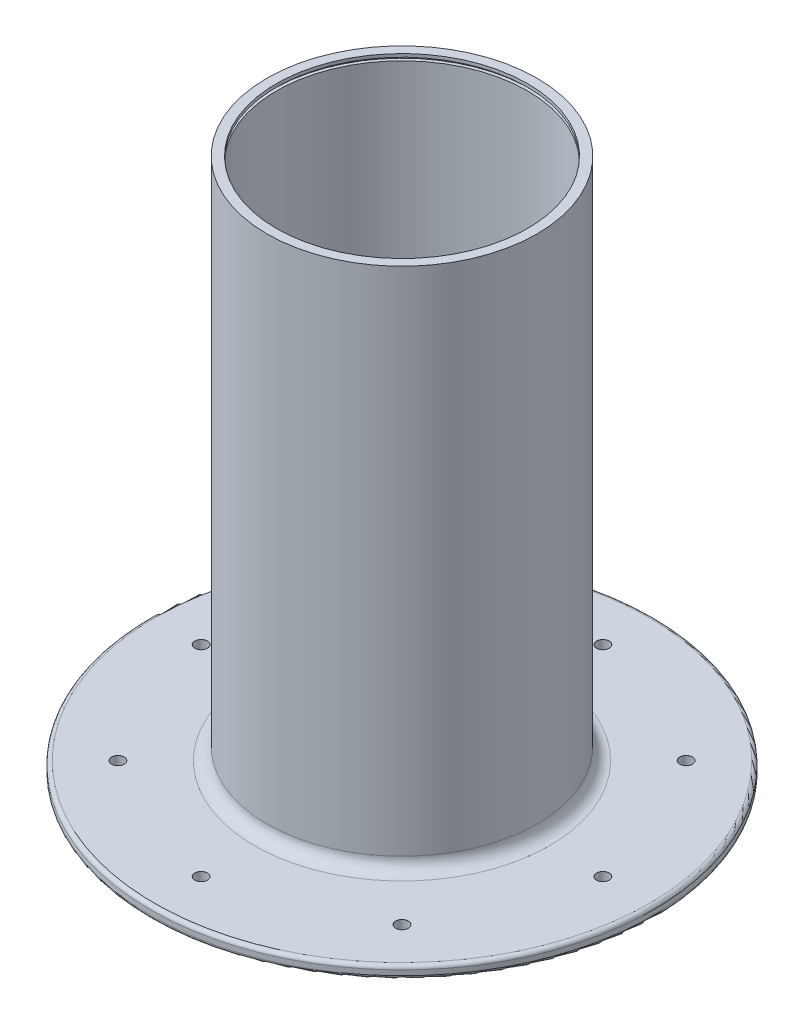
from build123d import *

# Parameters (mm, degrees)
BOSS_EXTRUDE1_DEPTH              = 155
BOSS_EXTRUDE1_DEPTH_BACK         = 272
SKETCH1_R                        = 107.5
SKETCH1_R_2                      = 100
SKETCH1_3_R                      = 100
SKETCH1_3_R_2                    = 95
SKETCH1_3_R_3                    = 31
BOSS_EXTRUDE2_DEPTH              = 17
SKETCH1_5_R                      = 95
SKETCH1_5_R_2                    = 31
CUT_EXTRUDE1_DEPTH               = 4
F_4_0MM_DOWEL_HOLE1_D            = 4
F_4_0MM_DOWEL_HOLE1_CSINK_D      = 4.05
F_4_0MM_DOWEL_HOLE1_CSINK_ANGLE  = 90
CUT_EXTRUDE2_DEPTH               = 5
SKETCH8_R                        = 200
SKETCH8_R_2                      = 100
BOSS_EXTRUDE3_DEPTH              = 10
F_10_0MM_DOWEL_HOLE1_D           = 10
F_10_0MM_DOWEL_HOLE1_CSINK_D     = 10.05
F_10_0MM_DOWEL_HOLE1_CSINK_ANGLE = 90
SKETCH12_R                       = 102.5
CUT_EXTRUDE3_DEPTH               = 2.5
FILLET1_R                        = 10
FILLET2_R                        = 3
FILLET3_R                        = 1


with BuildPart() as part:
    # Sketch1 → Boss-Extrude1 (new, two sides: drawn at the far end of the back side and taken through both)
    with BuildSketch(Plane(origin=(0, 0, 0), x_dir=(1, 0, 0), z_dir=(0, 1, 0)).offset(-BOSS_EXTRUDE1_DEPTH_BACK)):
        with Locations(Location((0, 0, 0), (0, 0, 270))):
            Circle(SKETCH1_R)
        with Locations(Location((0, 0, 0), (0, 0, 270))):
            Circle(SKETCH1_R_2, mode=Mode.SUBTRACT)
    extrude(amount=BOSS_EXTRUDE1_DEPTH + BOSS_EXTRUDE1_DEPTH_BACK)

    # Sketch1<3> → Boss-Extrude2 (add)
    # profile 1 of 2: a face of its own
    with BuildSketch(Plane(origin=(0, 0, 0), x_dir=(1, 0, 0), z_dir=(0, 1, 0))):
        with Locations(Location((0, 0, 0), (0, 0, 270))):
            Circle(SKETCH1_3_R)
        Circle(SKETCH1_3_R_2, mode=Mode.SUBTRACT)
    # profile 2 of 2: a face of its own
    with BuildSketch(Plane(origin=(0, 0, 0), x_dir=(1, 0, 0), z_dir=(0, 1, 0))):
        Circle(SKETCH1_3_R_2)
        with Locations(Location((0, 0, 0), (0, 0, 270))):
            Circle(SKETCH1_3_R_3, mode=Mode.SUBTRACT)
    extrude(amount=-BOSS_EXTRUDE2_DEPTH)

    # Sketch1<5> → Cut-Extrude1 (cut)
    with BuildSketch(Plane(origin=(0, 0, 0), x_dir=(1, 0, 0), z_dir=(0, 1, 0))):
        with Locations(Location((0, 0, 0), (0, 0, 270))):
            Circle(SKETCH1_5_R)
        with Locations(Location((0, 0, 0), (0, 0, 270))):
            Circle(SKETCH1_5_R_2, mode=Mode.SUBTRACT)
    extrude(amount=-CUT_EXTRUDE1_DEPTH, mode=Mode.SUBTRACT)

    # Ø4.0mm Dowel Hole1 (through all)
    with Locations(Plane(origin=(0, -17, 0), x_dir=(-1, 0, 0), z_dir=(0, -1, 0))):
        with Locations((0, 70), (49.497474683, 49.497474683), (-49.497474683, 49.497474683), (-70, 0), (-49.497474683, -49.497474683), (0, -70), (49.497474683, -49.497474683), (70, 0)):
            CounterSinkHole(F_4_0MM_DOWEL_HOLE1_D / 2, F_4_0MM_DOWEL_HOLE1_CSINK_D / 2, counter_sink_angle=F_4_0MM_DOWEL_HOLE1_CSINK_ANGLE)

    # Sketch5 → Cut-Extrude2 (cut)
    with BuildSketch(Plane(origin=(0, -4, 0), x_dir=(1, 0, 0), z_dir=(0, 1, 0))):
        Polygon((46.394787676, 46.394787676), (50.633136948, 45.259125411), (53.735823955, 48.361812418), (52.600161691, 52.600161691), (48.361812418, 53.735823955), (45.259125411, 50.633136948), align=None)
        Polygon((0, 65.612137954), (3.8, 67.806068977), (3.8, 72.193931023), (0, 74.387862046), (-3.8, 72.193931023), (-3.8, 67.806068977), align=None)
        Polygon((65.612137954, 0), (67.806068977, -3.8), (72.193931023, -3.8), (74.387862046, 0), (72.193931023, 3.8), (67.806068977, 3.8), align=None)
        Polygon((46.394787676, -46.394787676), (45.259125411, -50.633136948), (48.361812418, -53.735823955), (52.600161691, -52.600161691), (53.735823955, -48.361812418), (50.633136948, -45.259125411), align=None)
        Polygon((0, -65.612137954), (-3.8, -67.806068977), (-3.8, -72.193931023), (0, -74.387862046), (3.8, -72.193931023), (3.8, -67.806068977), align=None)
        Polygon((-46.394787676, -46.394787676), (-50.633136948, -45.259125411), (-53.735823955, -48.361812418), (-52.600161691, -52.600161691), (-48.361812418, -53.735823955), (-45.259125411, -50.633136948), align=None)
        Polygon((-65.612137954, 0), (-67.806068977, 3.8), (-72.193931023, 3.8), (-74.387862046, 0), (-72.193931023, -3.8), (-67.806068977, -3.8), align=None)
        Polygon((-46.394787676, 46.394787676), (-45.259125411, 50.633136948), (-48.361812418, 53.735823955), (-52.600161691, 52.600161691), (-53.735823955, 48.361812418), (-50.633136948, 45.259125411), align=None)
    extrude(amount=-CUT_EXTRUDE2_DEPTH, mode=Mode.SUBTRACT)

    # Sketch8 → Boss-Extrude3 (add)
    with BuildSketch(Plane(origin=(0, -272, 0), x_dir=(-1, 0, 0), z_dir=(0, -1, 0))):
        with Locations(Location((0, 0, 0), (0, 0, 90))):
            Circle(SKETCH8_R)
        with Locations(Location((0, 0, 0), (0, 0, 270))):
            Circle(SKETCH8_R_2, mode=Mode.SUBTRACT)
    extrude(amount=-BOSS_EXTRUDE3_DEPTH)

    # Ø10.0mm Dowel Hole1 (through all)
    with Locations(Plane(origin=(0, -262, 0), x_dir=(1, 0, 0), z_dir=(0, 1, 0))):
        with Locations((160, 0), (113.13708499, 113.13708499), (0, 160), (-113.13708499, 113.13708499), (-160, 0), (-113.13708499, -113.13708499), (113.13708499, -113.13708499), (0, -160)):
            CounterSinkHole(F_10_0MM_DOWEL_HOLE1_D / 2, F_10_0MM_DOWEL_HOLE1_CSINK_D / 2, counter_sink_angle=F_10_0MM_DOWEL_HOLE1_CSINK_ANGLE)

    # Sketch12 → Cut-Extrude3 (cut)
    with BuildSketch(Plane(origin=(0, 150, 0), x_dir=(1, 0, 0), z_dir=(0, 1, 0))):
        with Locations(Location((0, 0, 0), (0, 0, 270))):
            Circle(SKETCH12_R)
    extrude(amount=CUT_EXTRUDE3_DEPTH, mode=Mode.SUBTRACT)

    # Fillet1
    fillet1_edges = [part.edges().sort_by_distance(p)[0] for p in [
        (0, -17, -100),
        (0, -262, -107.5),
        (0, -272, -100),
    ]]
    fillet(fillet1_edges, radius=FILLET1_R)

    # Fillet2
    fillet2_edges = [part.edges().sort_by_distance(p)[0] for p in [
        (0, -262, 200),
        (0, -272, 200),
    ]]
    fillet(fillet2_edges, radius=FILLET2_R)

    # Fillet3
    fillet3_edges = [part.edges().sort_by_distance(p)[0] for p in [
        (0, 0, -100),
        (0, -4, -95),
    ]]
    fillet(fillet3_edges, radius=FILLET3_R)


solid = part.part
